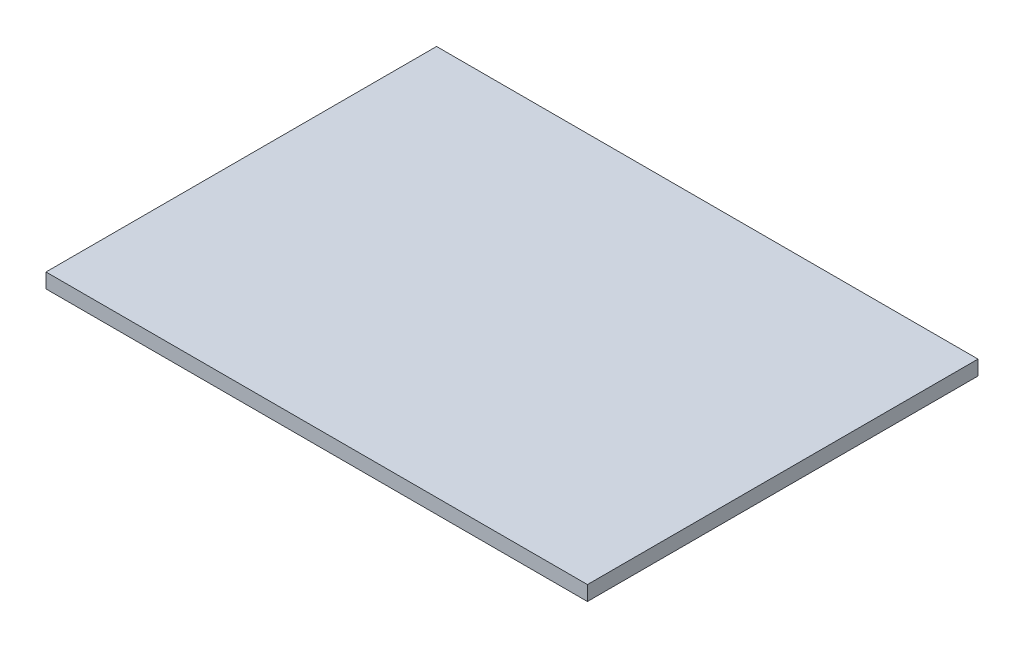
from build123d import *

# Parameters (mm, degrees)
SKETCH1_W           = 26.7
SKETCH1_H           = 19.26
BOSS_EXTRUDE2_DEPTH = 0.725


with BuildPart() as part:
    # Sketch1 → Boss-Extrude2 (new body)
    with BuildSketch(Plane(origin=(0, 0, 0), x_dir=(1, 0, 0), z_dir=(0, 1, 0))):
        with Locations((-13.35, 9.63)):
            Rectangle(SKETCH1_W, SKETCH1_H)
    extrude(amount=BOSS_EXTRUDE2_DEPTH)


solid = part.part
